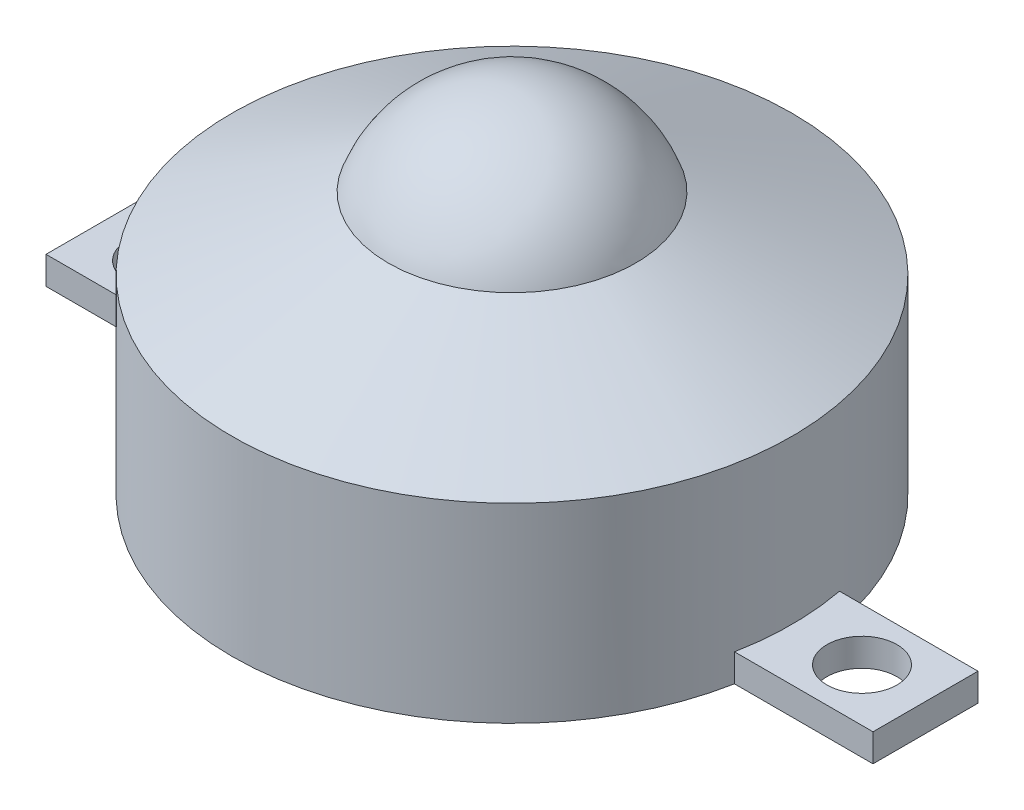
from build123d import *
from build123d.topology import SkipClean

# Parameters (mm, degrees)
SKETCH5_R           = 2
BOSS_EXTRUDE1_DEPTH = 1.5875


with BuildPart() as part:
    # Sketch1 → Revolve2 (revolve)
    with BuildSketch(Plane.XY, mode=Mode.PRIVATE) as revolve2_sk:
        with BuildLine():
            ThreePointArc((0, 20), (4.32968577, 18.623685679), (7.07, 15))
            Line((7.07, 15), (16, 10.891346557))
            Line((16, 10.891346557), (16, 0))
            Line((16, 0), (0, 0))
            Line((0, 0), (0, 20))
        make_face()
    revolve(revolve2_sk.sketch.rotate(Axis((0, 0, 0), (0, 1, 0)), 90), axis=Axis((0, 0, 0), (0, 1, 0)))

    # Sketch5 → Boss-Extrude1 (add)
    with SkipClean():  # the faces are left unmerged after this step: merging them gives an invalid solid
        with BuildSketch(Plane.XZ):
            with BuildLine():
                Line((23.630800275, 0), (23.630800275, 3))
                Line((23.630800275, 3), (15.716233646, 3))
                ThreePointArc((15.716233646, 3), (0, 16), (-15.716233646, 3))
                Line((-15.716233646, 3), (-23.630800275, 3))
                Line((-23.630800275, 3), (-23.630800275, 0))
                Line((-23.630800275, 0), (-23.630800275, -3))
                Line((-23.630800275, -3), (-15.716233646, -3))
                ThreePointArc((-15.716233646, -3), (0, -16), (15.716233646, -3))
                Line((15.716233646, -3), (23.630800275, -3))
                Line((23.630800275, -3), (23.630800275, 0))
            make_face()
            with Locations(Location((-20, 0, 0), (0, 0, 270))):
                Circle(SKETCH5_R, mode=Mode.SUBTRACT)
            with Locations(Location((20, 0, 0), (0, 0, 270))):
                Circle(SKETCH5_R, mode=Mode.SUBTRACT)
        extrude(amount=-BOSS_EXTRUDE1_DEPTH)


solid = part.part
